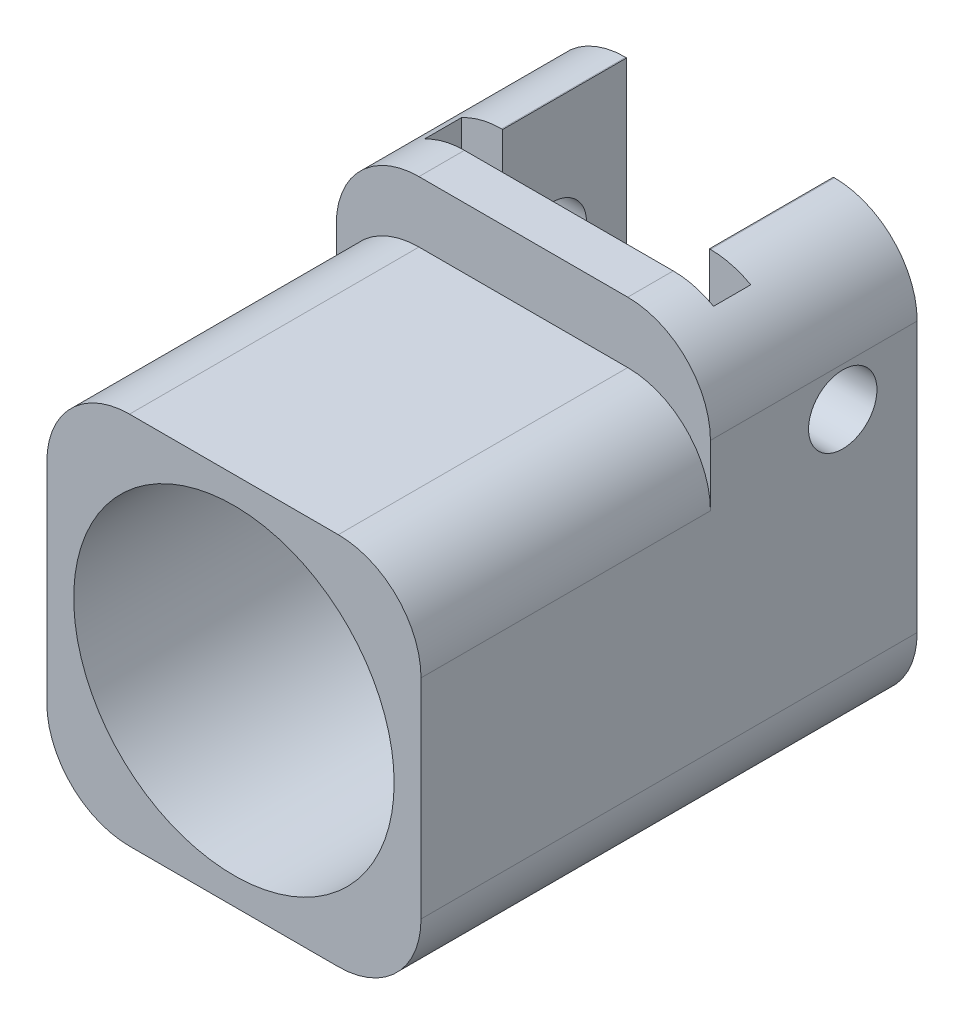
from build123d import *

# Parameters (mm, degrees)
BOSS_EXTRUDE1_DEPTH = 24
BOSS_EXTRUDE3_DEPTH = 10
SKETCH17_R          = 1.655
CUT_EXTRUDE10_DEPTH = 30
CUT_EXTRUDE11_DEPTH = 6
CUT_EXTRUDE12_DEPTH = 1.8
CUT_EXTRUDE13_DEPTH = 7.2
SKETCH24_R          = 7.75
CUT_EXTRUDE15_DEPTH = 14


with BuildPart() as part:
    # Sketch1 → Boss-Extrude1 (new body)
    with BuildSketch(Plane.XY):
        with BuildLine():
            Line((-5.05, 9.05), (5.05, 9.05))
            ThreePointArc((5.05, 9.05), (7.878427125, 7.878427125), (9.05, 5.05))
            Line((9.05, 5.05), (9.05, -5.05))
            ThreePointArc((9.05, -5.05), (7.878427125, -7.878427125), (5.05, -9.05))
            Line((5.05, -9.05), (-5.05, -9.05))
            ThreePointArc((-5.05, -9.05), (-7.878427125, -7.878427125), (-9.05, -5.05))
            Line((-9.05, -5.05), (-9.05, 5.05))
            ThreePointArc((-9.05, 5.05), (-7.878427125, 7.878427125), (-5.05, 9.05))
        make_face()
    extrude(amount=BOSS_EXTRUDE1_DEPTH)

    # Sketch15 → Boss-Extrude3 (add)
    with BuildSketch(Plane.XY):
        with BuildLine():
            Line((-5.05, -9.05), (5.05, -9.05))
            ThreePointArc((5.05, -9.05), (7.878427125, -7.878427125), (9.05, -5.05))
            Line((9.05, -5.05), (9.05, 8))
            ThreePointArc((9.05, 8), (7.878427125, 10.828427125), (5.05, 12))
            Line((5.05, 12), (-5.05, 12))
            ThreePointArc((-5.05, 12), (-7.878427125, 10.828427125), (-9.05, 8))
            Line((-9.05, 8), (-9.05, -5.05))
            ThreePointArc((-9.05, -5.05), (-7.878427125, -7.878427125), (-5.05, -9.05))
        make_face()
    extrude(amount=BOSS_EXTRUDE3_DEPTH)

    # Sketch17 → Cut-Extrude10 (cut)
    with BuildSketch(Plane(origin=(9.05, 0, 0), x_dir=(0, 0, -1), z_dir=(1, 0, 0))):
        with Locations((-3.6, 6.1)):
            Circle(SKETCH17_R)
    extrude(amount=-CUT_EXTRUDE10_DEPTH, mode=Mode.SUBTRACT)

    # Sketch18 → Cut-Extrude11 (cut)
    with BuildSketch(Plane.XY):
        Polygon((-4.996539756, -4.259182236), (-3.851088562, -6.946129507), (-2.048481088, -4.559068161), (-0.563070773, -7.21717083), (0.983895836, -4.624244345), (2.704822485, -7.21717083), (3.469678774, -4.870091009), (4.674482161, -7.026054964), (4.998172504, -5.668676456), (4.998172504, 5.373520003), (-4.996539756, 5.373520003), align=None)
    extrude(amount=CUT_EXTRUDE11_DEPTH, mode=Mode.SUBTRACT)

    # Sketch20 → Cut-Extrude12 (cut)
    with BuildSketch(Plane(origin=(0, 0, 6), x_dir=(-1, 0, 0), z_dir=(0, 0, -1))):
        Polygon((-7, 0), (-7, 13.473809321), (7, 13.473809321), (7, 0), (7, -7.194424303), (-7, -7.194424303), align=None)
    extrude(amount=-CUT_EXTRUDE12_DEPTH, mode=Mode.SUBTRACT)

    # Sketch21 → Cut-Extrude13 (cut)
    with BuildSketch(Plane.XY):
        Polygon((5, 17.493725323), (-5, 17.493725323), (-5, 0), (-5, -0.5), (5, -0.5), (5, 0), align=None)
    extrude(amount=CUT_EXTRUDE13_DEPTH, mode=Mode.SUBTRACT)

    # Sketch24 → Cut-Extrude15 (cut)
    with BuildSketch(Plane.XY.offset(24)):
        Circle(SKETCH24_R)
    extrude(amount=-CUT_EXTRUDE15_DEPTH, mode=Mode.SUBTRACT)


solid = part.part
